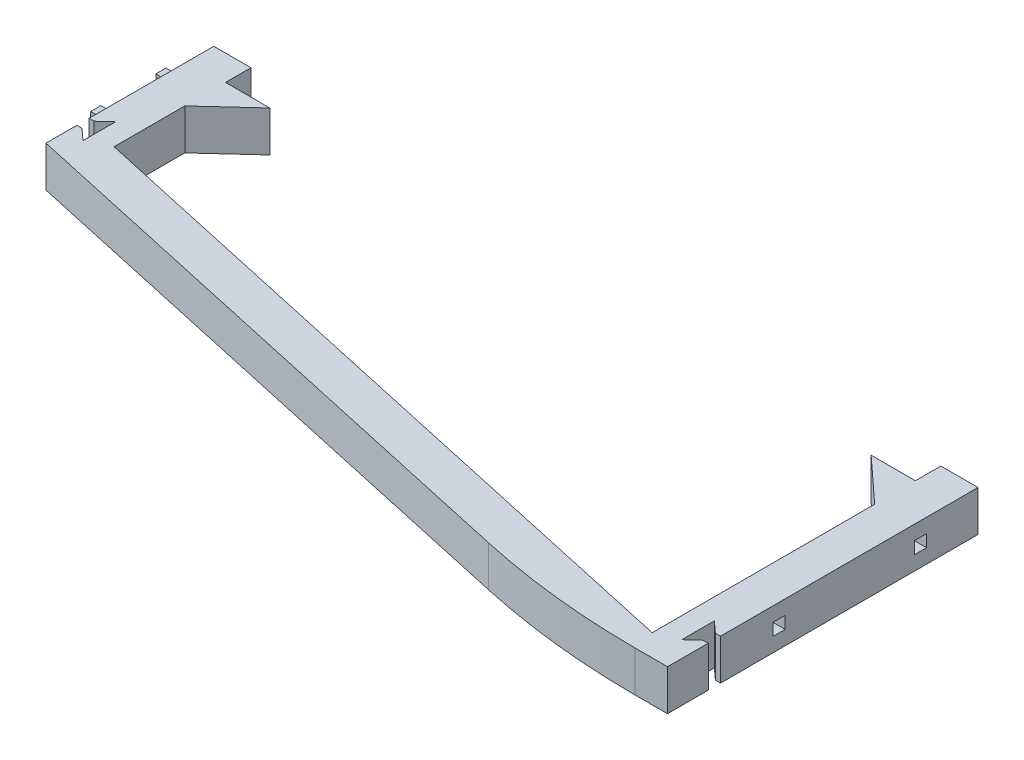
from build123d import *

# Parameters (mm, degrees)
P_IDAT_VYSUNUT_M1_DEPTH  = 8
ODEBRAT_VYSUNUT_M1_DEPTH = 165.210299616
SKICA6_W                 = 16
SKICA6_H                 = 8
P_IDAT_VYSUNUT_M3_DEPTH  = 8
ODEBRAT_VYSUNUT_M4_DEPTH = 165.210299616
SKICA4_W                 = 2.4
SKICA4_H                 = 2.4
ODEBRAT_VYSUNUT_M2_DEPTH = 4.4
SKICA5_W                 = 2
SKICA5_H                 = 2
P_IDAT_VYSUNUT_M2_DEPTH  = 4
ODEBRAT_VYSUNUT_M5_DEPTH = 168.875616157
ODEBRAT_VYSUNUT_M6_DEPTH = 168.875616157
ZAOBLIT1_R               = 150


with BuildPart() as part:
    # Skica1 → Přidat vysunutím1 (new body)
    with BuildSketch(Plane(origin=(0, 0, 0), x_dir=(1, 0, 0), z_dir=(0, 1, 0))):
        Polygon((0, 0), (0, -66), (-150.15, -32.97), (-150.15, 0), (-142.85, 0), (-142.85, -26.8965309), (-7.3, -56.714822608), (-7.3, 0), align=None)
    extrude(amount=P_IDAT_VYSUNUT_M1_DEPTH)

    # Skica3 → Odebrat vysunutím1 (cut, through all)
    with BuildSketch(Plane(origin=(0, 8, 0), x_dir=(1, 0, 0), z_dir=(0, 1, 0))):
        Polygon((-1, -50.6), (-3.2, -48.6), (-3.2, -55), (-1, -53), (0, -53), (0, -50.6), align=None)
    extrude(amount=-ODEBRAT_VYSUNUT_M1_DEPTH, mode=Mode.SUBTRACT)

    # Skica6 → Přidat vysunutím3 (add)
    with BuildSketch(Plane(origin=(0, 8, 0), x_dir=(1, 0, 0), z_dir=(0, 1, 0))):
        with Locations((-142.15, -9)):
            Rectangle(SKICA6_W, SKICA6_H)
        with Locations((-8, -9)):
            Rectangle(SKICA6_W, SKICA6_H)
    extrude(amount=-P_IDAT_VYSUNUT_M3_DEPTH)

    # Skica9 → Odebrat vysunutím4 (cut, through all)
    with BuildSketch(Plane.XZ):
        Polygon((-142.85, 13), (-134.15, 13), (-134.15, 5), align=None)
        Polygon((-16, 13), (-7.3, 13), (-16, 5), align=None)
    extrude(amount=-ODEBRAT_VYSUNUT_M4_DEPTH, mode=Mode.SUBTRACT)

    # Skica4 → Odebrat vysunutím2 (cut)
    with BuildSketch(Plane(origin=(0, 0, 0), x_dir=(0, 0, -1), z_dir=(1, 0, 0))):
        with Locations((-39.1, 4)):
            Rectangle(SKICA4_W, SKICA4_H)
        with Locations((-11.3, 4)):
            Rectangle(SKICA4_W, SKICA4_H)
    extrude(amount=-ODEBRAT_VYSUNUT_M2_DEPTH, mode=Mode.SUBTRACT)

    # Skica5 → Přidat vysunutím2 (add)
    with BuildSketch(Plane.ZY.offset(150.15)):
        with Locations((6.4, 4)):
            Rectangle(SKICA5_W, SKICA5_H)
        with Locations((19.2, 4)):
            Rectangle(SKICA5_W, SKICA5_H)
    extrude(amount=P_IDAT_VYSUNUT_M2_DEPTH)

    # Skica10 → Odebrat vysunutím5 (cut, through all)
    with BuildSketch(Plane(origin=(0, 8, 0), x_dir=(1, 0, 0), z_dir=(0, 1, 0))):
        Polygon((-150.15, -26.9), (-149.15, -26.9), (-146.95, -28.9), (-146.95, -22.5), (-149.15, -24.5), (-150.15, -24.5), align=None)
    extrude(amount=-ODEBRAT_VYSUNUT_M5_DEPTH, mode=Mode.SUBTRACT)

    # Skica11 → Odebrat vysunutím6 (cut, through all)
    with BuildSketch(Plane(origin=(0, 8, 0), x_dir=(1, 0, 0), z_dir=(0, 1, 0))):
        Polygon((0, -61), (-22.729336966, -61), (0, -66), align=None)
    extrude(amount=-ODEBRAT_VYSUNUT_M6_DEPTH, mode=Mode.SUBTRACT)

    # Zaoblit1
    zaoblit1_edges = [part.edges().sort_by_distance(p)[0] for p in [
        (-22.729336966, 4, 61),
    ]]
    fillet(zaoblit1_edges, radius=ZAOBLIT1_R)


solid = part.part
